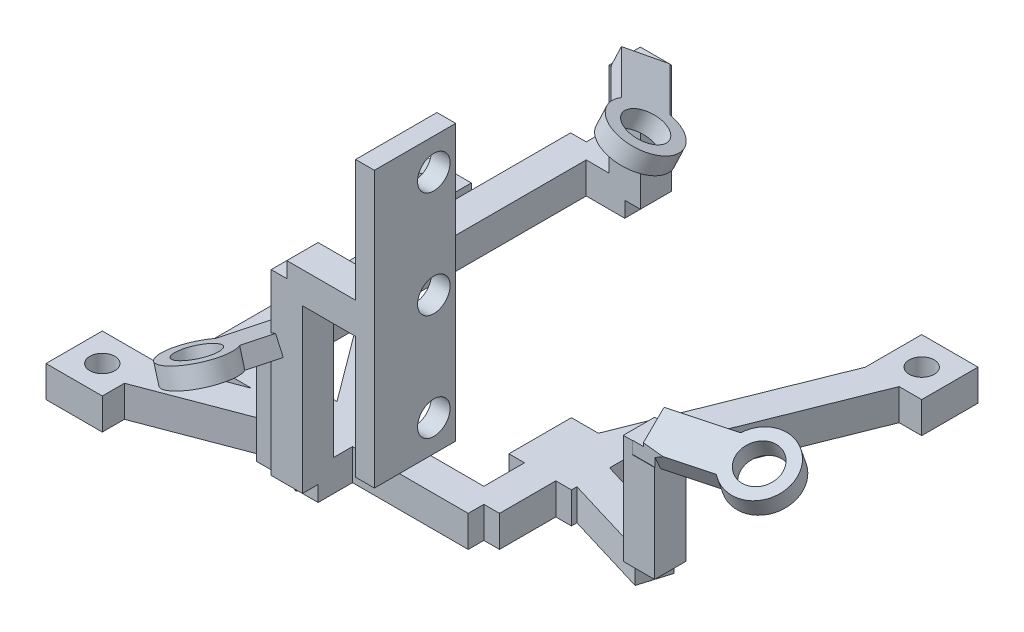
from build123d import *

# Parameters (mm, degrees)
CABLE_FAIRLEAD_SUPPORT_FRAME_FEATURE_PRO_W     = 10
CABLE_FAIRLEAD_SUPPORT_FRAME_FEATURE_PRO_H     = 5
CABLE_FAIRLEAD_SUPPORT_FRAME_FEATURE_DEPTH     = 10
FRAME_UPPER_TRUNK_SKETCH_W                     = 5
FRAME_UPPER_TRUNK_SKETCH_H                     = 5
FRAME_UPPER_TRUNK_FEATURE_DEPTH                = 14
FRAME_LEFT_TRUNK_SKETCH_W                      = 5
FRAME_LEFT_TRUNK_SKETCH_H                      = 5
FRAME_LEFT_TRUNK_FEATURE_DEPTH                 = 21
FIXED_FRAME_MOUNTING_WEB_1_SKETCH_W            = 5
FIXED_FRAME_MOUNTING_WEB_1_SKETCH_H            = 5
FIXED_FRAME_MOUNTING_WEB_1_FEATURE_DEPTH       = 48.600411521
PRISMATIC_M4_MOUNTING_PAD_1_PROFILE_W          = 9
PRISMATIC_M4_MOUNTING_PAD_1_PROFILE_H          = 5
PRISMATIC_M4_MOUNTING_PAD_1_DEPTH              = 9
NOMINAL_M4_MOUNTING_THREAD_1_PROFILE_R         = 2
NOMINAL_M4_MOUNTING_THREAD_1_DEPTH             = 9.1
FIXED_FRAME_MOUNTING_WEB_2_SKETCH_W            = 5
FIXED_FRAME_MOUNTING_WEB_2_SKETCH_H            = 5
FIXED_FRAME_MOUNTING_WEB_2_FEATURE_DEPTH       = 31.016124839
PRISMATIC_M4_MOUNTING_PAD_2_PROFILE_W          = 9
PRISMATIC_M4_MOUNTING_PAD_2_PROFILE_H          = 5
PRISMATIC_M4_MOUNTING_PAD_2_DEPTH              = 9
NOMINAL_M4_MOUNTING_THREAD_2_PROFILE_R         = 2
NOMINAL_M4_MOUNTING_THREAD_2_DEPTH             = 9.1
FIXED_FRAME_MOUNTING_WEB_3_SKETCH_W            = 5
FIXED_FRAME_MOUNTING_WEB_3_SKETCH_H            = 5
FIXED_FRAME_MOUNTING_WEB_3_FEATURE_DEPTH       = 43.081318457
PRISMATIC_M4_MOUNTING_PAD_3_PROFILE_W          = 9
PRISMATIC_M4_MOUNTING_PAD_3_PROFILE_H          = 5
PRISMATIC_M4_MOUNTING_PAD_3_DEPTH              = 9
NOMINAL_M4_MOUNTING_THREAD_3_PROFILE_R         = 2
NOMINAL_M4_MOUNTING_THREAD_3_DEPTH             = 9.1
OUTLET_SIDE_RISE_SKETCH_W                      = 5
OUTLET_SIDE_RISE_SKETCH_H                      = 5
OUTLET_SIDE_RISE_FEATURE_DEPTH                 = 8
OUTLET_LATERAL_RETURN_SKETCH_W                 = 5
OUTLET_LATERAL_RETURN_SKETCH_H                 = 5
OUTLET_LATERAL_RETURN_FEATURE_DEPTH            = 28.5
OUTLET_RAIL_BRIDGE_SKETCH_W                    = 5
OUTLET_RAIL_BRIDGE_SKETCH_H                    = 5
OUTLET_RAIL_BRIDGE_FEATURE_DEPTH               = 13
INTEGRAL_THREE_LANE_CABLE_OUTLET_CLA_2_W       = 3
INTEGRAL_THREE_LANE_CABLE_OUTLET_CLA_2_H       = 44
INTEGRAL_THREE_LANE_CABLE_OUTLET_CLAMP_R_DEPTH = 13
INLET_OUTRIGGER_WEB_1_SKETCH_W                 = 5
INLET_OUTRIGGER_WEB_1_SKETCH_H                 = 5
INLET_OUTRIGGER_WEB_1_FEATURE_DEPTH            = 19.897129262
INLET_VERTICAL_SUPPORT_1_SKETCH_W              = 5
INLET_VERTICAL_SUPPORT_1_SKETCH_H              = 5
INLET_VERTICAL_SUPPORT_1_FEATURE_DEPTH         = 17.458078567
INLET_COLLAR_RETAINING_WEB_1_FEATURE_DEPTH     = 14
INTEGRAL_CABLE_GUIDE_CLAMP_1_PROFILE_R         = 5
INTEGRAL_CABLE_GUIDE_CLAMP_1_DEPTH             = 2.99
FINAL_CABLE_INLET_CLAMP_THROUGH_BORE_1_P_R     = 3.1
FINAL_CABLE_INLET_CLAMP_THROUGH_BORE_1_DEPTH   = 7.2
INLET_OUTRIGGER_WEB_2_SKETCH_W                 = 5
INLET_OUTRIGGER_WEB_2_SKETCH_H                 = 5
INLET_OUTRIGGER_WEB_2_FEATURE_DEPTH            = 7.887446615
INLET_VERTICAL_SUPPORT_2_SKETCH_W              = 5
INLET_VERTICAL_SUPPORT_2_SKETCH_H              = 5
INLET_VERTICAL_SUPPORT_2_FEATURE_DEPTH         = 17.453498372
INLET_COLLAR_RETAINING_WEB_2_FEATURE_DEPTH     = 11.5
INTEGRAL_CABLE_GUIDE_CLAMP_2_PROFILE_R         = 5
INTEGRAL_CABLE_GUIDE_CLAMP_2_DEPTH             = 2.98
FINAL_CABLE_INLET_CLAMP_THROUGH_BORE_2_P_R     = 3.1
FINAL_CABLE_INLET_CLAMP_THROUGH_BORE_2_DEPTH   = 7.2
THIRD_INLET_CABLE_SWEEP_LEFT_BYPASS_SKET_W     = 5
THIRD_INLET_CABLE_SWEEP_LEFT_BYPASS_SKET_H     = 5
THIRD_INLET_CABLE_SWEEP_LEFT_BYPASS_FEAT_DEPTH = 21
THIRD_INLET_CABLE_SWEEP_LOWER_BYPASS_SKE_W     = 5
THIRD_INLET_CABLE_SWEEP_LOWER_BYPASS_SKE_H     = 5
THIRD_INLET_CABLE_SWEEP_LOWER_BYPASS_FEA_DEPTH = 58.366913444
THIRD_INLET_CABLE_SWEEP_RETURN_SKETCH_W        = 5
THIRD_INLET_CABLE_SWEEP_RETURN_SKETCH_H        = 5
THIRD_INLET_CABLE_SWEEP_RETURN_FEATURE_DEPTH   = 8.658958227
INLET_VERTICAL_SUPPORT_3_SKETCH_W              = 5
INLET_VERTICAL_SUPPORT_3_SKETCH_H              = 5
INLET_VERTICAL_SUPPORT_3_FEATURE_DEPTH         = 17.458078567
INLET_COLLAR_RETAINING_WEB_3_FEATURE_DEPTH     = 14
INTEGRAL_CABLE_GUIDE_CLAMP_3_PROFILE_R         = 5
INTEGRAL_CABLE_GUIDE_CLAMP_3_DEPTH             = 2.99
FINAL_CABLE_INLET_CLAMP_THROUGH_BORE_3_P_R     = 3.1
FINAL_CABLE_INLET_CLAMP_THROUGH_BORE_3_DEPTH   = 7.2
CABLE_OUTLET_CLAMP_BORE_1_PROFILE_R            = 2.6
CABLE_OUTLET_CLAMP_BORE_1_DEPTH                = 7.4
CABLE_OUTLET_CLAMP_BORE_2_PROFILE_R            = 2.6
CABLE_OUTLET_CLAMP_BORE_2_DEPTH                = 7.4
OUTLET_REAR_NUT_SEATING_CLEARANCE_2_PROF_R     = 4.75
OUTLET_REAR_NUT_SEATING_CLEARANCE_2_DEPTH      = 2.1
CABLE_OUTLET_CLAMP_BORE_3_PROFILE_R            = 2.6
CABLE_OUTLET_CLAMP_BORE_3_DEPTH                = 7.4
FIRST_INLET_WEB_COMB_CORNER_CLEARANCE_PR_W     = 5
FIRST_INLET_WEB_COMB_CORNER_CLEARANCE_PR_H     = 4
FIRST_INLET_WEB_COMB_CORNER_CLEARANCE_DEPTH    = 1.3
FIRST_WALL_MOUNT_OUTER_CORNER_RAIL_H_2_W       = 1.8
FIRST_WALL_MOUNT_OUTER_CORNER_RAIL_H_2_H       = 1.3
FIRST_WALL_MOUNT_OUTER_CORNER_RAIL_HEAD_DEPTH  = 5.1


with BuildPart() as part:
    # Cable Fairlead Support Frame Feature pro → Cable Fairlead Support Frame Feature (new body)
    with BuildSketch(Plane.XY.offset(-5)):
        with Locations((-50.291651246, -57.5)):
            Rectangle(CABLE_FAIRLEAD_SUPPORT_FRAME_FEATURE_PRO_W, CABLE_FAIRLEAD_SUPPORT_FRAME_FEATURE_PRO_H)
    extrude(amount=CABLE_FAIRLEAD_SUPPORT_FRAME_FEATURE_DEPTH)

    # Frame Upper Trunk Sketch → Frame Upper Trunk Feature (add)
    with BuildSketch(Plane.XY):
        with Locations((-50.291651246, -57.5)):
            Rectangle(FRAME_UPPER_TRUNK_SKETCH_W, FRAME_UPPER_TRUNK_SKETCH_H)
    extrude(amount=FRAME_UPPER_TRUNK_FEATURE_DEPTH)

    # Frame Left Trunk Sketch → Frame Left Trunk Feature (add)
    with BuildSketch(Plane.ZY.offset(50.291651246)):
        with Locations((14, -57.5)):
            Rectangle(FRAME_LEFT_TRUNK_SKETCH_W, FRAME_LEFT_TRUNK_SKETCH_H)
    extrude(amount=FRAME_LEFT_TRUNK_FEATURE_DEPTH)

    # Fixed Frame Mounting Web 1 Sketch → Fixed Frame Mounting Web 1 Feature (add)
    with BuildSketch(Plane(origin=(-18.680050253, 0, -25.121446892), x_dir=(-0.8024623409461341, 0, 0.59670276634456), z_dir=(-0.59670276634456, 0, -0.8024623409461341))):
        with Locations((65.562704078, -57.5)):
            Rectangle(FIXED_FRAME_MOUNTING_WEB_1_SKETCH_W, FIXED_FRAME_MOUNTING_WEB_1_SKETCH_H)
    extrude(amount=FIXED_FRAME_MOUNTING_WEB_1_FEATURE_DEPTH)

    # Prismatic M4 Mounting Pad 1 profile → Prismatic M4 Mounting Pad 1 (add)
    with BuildSketch(Plane.XY.offset(-29.5)):
        with Locations((-100.291651246, -57.5)):
            Rectangle(PRISMATIC_M4_MOUNTING_PAD_1_PROFILE_W, PRISMATIC_M4_MOUNTING_PAD_1_PROFILE_H)
    extrude(amount=PRISMATIC_M4_MOUNTING_PAD_1_DEPTH)

    # Nominal M4 Mounting Thread 1 profile → Nominal M4 Mounting Thread 1 (cut)
    with BuildSketch(Plane(origin=(0, -51, 0), x_dir=(-1, 0, 0), z_dir=(0, -1, 0))):
        with Locations(Location((100.291651246, 25, 0), (0, 0, 270))):
            Circle(NOMINAL_M4_MOUNTING_THREAD_1_PROFILE_R)
    extrude(amount=NOMINAL_M4_MOUNTING_THREAD_1_DEPTH, mode=Mode.SUBTRACT)

    # Fixed Frame Mounting Web 2 Sketch → Fixed Frame Mounting Web 2 Feature (add)
    with BuildSketch(Plane(origin=(-66.967025673, 0, 25.4012856), x_dir=(0.35465423412053826, 0, 0.9349975263177837), z_dir=(-0.9349975263177837, 0, 0.35465423412053826))):
        with Locations((-12.193920603, -57.5)):
            Rectangle(FIXED_FRAME_MOUNTING_WEB_2_SKETCH_W, FIXED_FRAME_MOUNTING_WEB_2_SKETCH_H)
    extrude(amount=FIXED_FRAME_MOUNTING_WEB_2_FEATURE_DEPTH)

    # Prismatic M4 Mounting Pad 2 profile → Prismatic M4 Mounting Pad 2 (add)
    with BuildSketch(Plane.XY.offset(20.5)):
        with Locations((-100.291651246, -57.5)):
            Rectangle(PRISMATIC_M4_MOUNTING_PAD_2_PROFILE_W, PRISMATIC_M4_MOUNTING_PAD_2_PROFILE_H)
    extrude(amount=PRISMATIC_M4_MOUNTING_PAD_2_DEPTH)

    # Nominal M4 Mounting Thread 2 profile → Nominal M4 Mounting Thread 2 (cut)
    with BuildSketch(Plane(origin=(0, -51, 0), x_dir=(-1, 0, 0), z_dir=(0, -1, 0))):
        with Locations(Location((100.291651246, -25, 0), (0, 0, 270))):
            Circle(NOMINAL_M4_MOUNTING_THREAD_2_PROFILE_R)
    extrude(amount=NOMINAL_M4_MOUNTING_THREAD_2_DEPTH, mode=Mode.SUBTRACT)

    # Fixed Frame Mounting Web 3 Sketch → Fixed Frame Mounting Web 3 Feature (add)
    with BuildSketch(Plane(origin=(-6.936779482, 0, 17.341948706), x_dir=(-0.9284766908852594, 0, -0.3713906763541037), z_dir=(0.37139067635410367, 0, -0.9284766908852593))):
        with Locations((46.694625928, -57.5)):
            Rectangle(FIXED_FRAME_MOUNTING_WEB_3_SKETCH_W, FIXED_FRAME_MOUNTING_WEB_3_SKETCH_H)
    extrude(amount=FIXED_FRAME_MOUNTING_WEB_3_FEATURE_DEPTH)

    # Prismatic M4 Mounting Pad 3 profile → Prismatic M4 Mounting Pad 3 (add)
    with BuildSketch(Plane.XY.offset(-44.5)):
        with Locations((-34.291651246, -57.5)):
            Rectangle(PRISMATIC_M4_MOUNTING_PAD_3_PROFILE_W, PRISMATIC_M4_MOUNTING_PAD_3_PROFILE_H)
    extrude(amount=PRISMATIC_M4_MOUNTING_PAD_3_DEPTH)

    # Nominal M4 Mounting Thread 3 profile → Nominal M4 Mounting Thread 3 (cut)
    with BuildSketch(Plane(origin=(0, -51, 0), x_dir=(-1, 0, 0), z_dir=(0, -1, 0))):
        with Locations(Location((34.291651246, 40, 0), (0, 0, 270))):
            Circle(NOMINAL_M4_MOUNTING_THREAD_3_PROFILE_R)
    extrude(amount=NOMINAL_M4_MOUNTING_THREAD_3_DEPTH, mode=Mode.SUBTRACT)

    # Outlet Side Rise Sketch → Outlet Side Rise Feature (add)
    with BuildSketch(Plane.XY.offset(14)):
        with Locations((-71.291651246, -57.5)):
            Rectangle(OUTLET_SIDE_RISE_SKETCH_W, OUTLET_SIDE_RISE_SKETCH_H)
    extrude(amount=OUTLET_SIDE_RISE_FEATURE_DEPTH)

    # Outlet Lateral Return Sketch → Outlet Lateral Return Feature (add)
    with BuildSketch(Plane(origin=(0, -57.5, 0), x_dir=(1, 0, 0), z_dir=(0, 1, 0))):
        with Locations((-71.291651246, -22)):
            Rectangle(OUTLET_LATERAL_RETURN_SKETCH_W, OUTLET_LATERAL_RETURN_SKETCH_H)
    extrude(amount=OUTLET_LATERAL_RETURN_FEATURE_DEPTH)

    # Outlet Rail Bridge Sketch → Outlet Rail Bridge Feature (add)
    with BuildSketch(Plane(origin=(-71.291651246, 0, 0), x_dir=(0, 0, -1), z_dir=(1, 0, 0))):
        with Locations((-22, -29)):
            Rectangle(OUTLET_RAIL_BRIDGE_SKETCH_W, OUTLET_RAIL_BRIDGE_SKETCH_H)
    extrude(amount=OUTLET_RAIL_BRIDGE_FEATURE_DEPTH)

    # Integral Three Lane Cable Outlet Cla 2 → Integral Three Lane Cable Outlet Clamp R (add)
    with BuildSketch(Plane.XY.offset(11.5)):
        with Locations((-58.791651246, -29)):
            Rectangle(INTEGRAL_THREE_LANE_CABLE_OUTLET_CLA_2_W, INTEGRAL_THREE_LANE_CABLE_OUTLET_CLA_2_H)
    extrude(amount=INTEGRAL_THREE_LANE_CABLE_OUTLET_CLAMP_R_DEPTH)

    # Inlet Outrigger Web 1 Sketch → Inlet Outrigger Web 1 Feature (add)
    with BuildSketch(Plane(origin=(-46.088198712, 0, -13.918676505), x_dir=(0.28910468276520457, 0, -0.9572974889778153), z_dir=(0.9572974889778154, 0, 0.28910468276520457))):
        with Locations((-14.539551879, -57.5)):
            Rectangle(INLET_OUTRIGGER_WEB_1_SKETCH_W, INLET_OUTRIGGER_WEB_1_SKETCH_H)
    extrude(amount=INLET_OUTRIGGER_WEB_1_FEATURE_DEPTH)

    # Inlet Vertical Support 1 Sketch → Inlet Vertical Support 1 Feature (add)
    with BuildSketch(Plane(origin=(0, -57.5, 0), x_dir=(1, 0, 0), z_dir=(0, 1, 0))):
        with Locations((-31.244179366, -5.752353243)):
            Rectangle(INLET_VERTICAL_SUPPORT_1_SKETCH_W, INLET_VERTICAL_SUPPORT_1_SKETCH_H)
    extrude(amount=INLET_VERTICAL_SUPPORT_1_FEATURE_DEPTH)

    # Inlet Collar Retaining Web 1 Sketch → Inlet Collar Retaining Web 1 Feature (add)
    with BuildSketch(Plane(origin=(-30.589304519, 0, 8.196379443), x_dir=(-0.2588190451025209, 0, -0.9659258262890683), z_dir=(0.9659258262890682, 0, -0.25881904510252085))):
        Polygon((-0.817503267, -39.875711022), (0.381753684, -42.614667532), (5.877987484, -40.208131845), (4.678730534, -37.469175335), align=None)
    extrude(amount=INLET_COLLAR_RETAINING_WEB_1_FEATURE_DEPTH)

    # Integral Cable Guide Clamp 1 profile → Integral Cable Guide Clamp 1 (add)
    with BuildSketch(Plane(origin=(-3.757886141, -33.160439592, -14.024622008), x_dir=(-0.9945971940532637, 0.09561015120206427, 0.040436624098617396), z_dir=(-0.10380954475082953, -0.916038966713815, -0.38742249532069234))):
        with Locations((13.883144322, -17.558147475)):
            Circle(INTEGRAL_CABLE_GUIDE_CLAMP_1_PROFILE_R)
    extrude(amount=INTEGRAL_CABLE_GUIDE_CLAMP_1_DEPTH)

    # Final Cable Inlet Clamp Through Bore 1 p → Final Cable Inlet Clamp Through Bore 1 (cut)
    with BuildSketch(Plane(origin=(-3.746467091, -33.059675306, -13.982005534), x_dir=(-0.9945971940532637, 0.09561015120206481, 0.040436624098617716), z_dir=(-0.10380954475083015, -0.9160389667138147, -0.3874224953206927))):
        with Locations(Location((13.883144322, -17.558147475, 0), (0, 0, 270))):
            Circle(FINAL_CABLE_INLET_CLAMP_THROUGH_BORE_1_P_R)
    extrude(amount=FINAL_CABLE_INLET_CLAMP_THROUGH_BORE_1_DEPTH, mode=Mode.SUBTRACT)

    # Inlet Outrigger Web 2 Sketch → Inlet Outrigger Web 2 Feature (add)
    with BuildSketch(Plane(origin=(-16.501146425, 0, 37.872417183), x_dir=(0.9167610626613684, 0, 0.39943604492834506), z_dir=(-0.39943604492834506, 0, 0.9167610626613684))):
        with Locations((-59.765305326, -57.5)):
            Rectangle(INLET_OUTRIGGER_WEB_2_SKETCH_W, INLET_OUTRIGGER_WEB_2_SKETCH_H)
    extrude(amount=INLET_OUTRIGGER_WEB_2_FEATURE_DEPTH)

    # Inlet Vertical Support 2 Sketch → Inlet Vertical Support 2 Feature (add)
    with BuildSketch(Plane(origin=(0, -57.5, 0), x_dir=(1, 0, 0), z_dir=(0, 1, 0))):
        with Locations((-74.442181727, -21.230903941)):
            Rectangle(INLET_VERTICAL_SUPPORT_2_SKETCH_W, INLET_VERTICAL_SUPPORT_2_SKETCH_H)
    extrude(amount=INLET_VERTICAL_SUPPORT_2_FEATURE_DEPTH)

    # Inlet Collar Retaining Web 2 Sketch → Inlet Collar Retaining Web 2 Feature (add)
    with BuildSketch(Plane(origin=(-10.294406604, 0, 38.419248481), x_dir=(0.9659258262890684, 0, 0.2588190451025205), z_dir=(-0.2588190451025205, 0, 0.9659258262890684))):
        Polygon((-69.756403539, -39.884871411), (-68.561157482, -42.614667532), (-63.064923681, -40.208131845), (-64.260169739, -37.478335724), align=None)
    extrude(amount=INLET_COLLAR_RETAINING_WEB_2_FEATURE_DEPTH)

    # Integral Cable Guide Clamp 2 profile → Integral Cable Guide Clamp 2 (add)
    with BuildSketch(Plane(origin=(3.315387624, -7.839049849, 0.888355436), x_dir=(-0.9219022779663189, -0.3849584828862101, 0.04362518005074423), z_dir=(0.387422495320693, -0.9160389667138146, 0.10380954475083053))):
        with Locations((88.199421816, -27.623992603)):
            Circle(INTEGRAL_CABLE_GUIDE_CLAMP_2_PROFILE_R)
    extrude(amount=INTEGRAL_CABLE_GUIDE_CLAMP_2_DEPTH)

    # Final Cable Inlet Clamp Through Bore 2 p → Final Cable Inlet Clamp Through Bore 2 (cut)
    with BuildSketch(Plane(origin=(3.268896925, -7.729125173, 0.875898291), x_dir=(-0.921902277966319, -0.38495848288620965, 0.04362518005074392), z_dir=(0.3874224953206925, -0.9160389667138148, 0.10380954475082999))):
        with Locations(Location((88.199421816, -27.623992603, 0), (0, 0, 2.513923103))):
            Circle(FINAL_CABLE_INLET_CLAMP_THROUGH_BORE_2_P_R)
    extrude(amount=FINAL_CABLE_INLET_CLAMP_THROUGH_BORE_2_DEPTH, mode=Mode.SUBTRACT)

    # Third Inlet Cable Sweep Left Bypass Sket → Third Inlet Cable Sweep Left Bypass Feature (add)
    with BuildSketch(Plane.ZY.offset(71.291651246)):
        with Locations((14, -57.5)):
            Rectangle(THIRD_INLET_CABLE_SWEEP_LEFT_BYPASS_SKET_W, THIRD_INLET_CABLE_SWEEP_LEFT_BYPASS_SKET_H)
    extrude(amount=THIRD_INLET_CABLE_SWEEP_LEFT_BYPASS_FEAT_DEPTH)

    # Third Inlet Cable Sweep Lower Bypass Ske → Third Inlet Cable Sweep Lower Bypass Feature (add)
    with BuildSketch(Plane(origin=(0, 0, 14), x_dir=(-1, 0, 0), z_dir=(0, 0, -1))):
        with Locations((92.291651246, -57.5)):
            Rectangle(THIRD_INLET_CABLE_SWEEP_LOWER_BYPASS_SKE_W, THIRD_INLET_CABLE_SWEEP_LOWER_BYPASS_SKE_H)
    extrude(amount=THIRD_INLET_CABLE_SWEEP_LOWER_BYPASS_FEA_DEPTH)

    # Third Inlet Cable Sweep Return Sketch → Third Inlet Cable Sweep Return Feature (add)
    with BuildSketch(Plane(origin=(-92.291651246, 0, 0), x_dir=(0, 0, -1), z_dir=(1, 0, 0))):
        with Locations((44.366913444, -57.5)):
            Rectangle(THIRD_INLET_CABLE_SWEEP_RETURN_SKETCH_W, THIRD_INLET_CABLE_SWEEP_RETURN_SKETCH_H)
    extrude(amount=THIRD_INLET_CABLE_SWEEP_RETURN_FEATURE_DEPTH)

    # Inlet Vertical Support 3 Sketch → Inlet Vertical Support 3 Feature (add)
    with BuildSketch(Plane(origin=(0, -57.5, 0), x_dir=(1, 0, 0), z_dir=(0, 1, 0))):
        with Locations((-83.632693019, 44.366913444)):
            Rectangle(INLET_VERTICAL_SUPPORT_3_SKETCH_W, INLET_VERTICAL_SUPPORT_3_SKETCH_H)
    extrude(amount=INLET_VERTICAL_SUPPORT_3_FEATURE_DEPTH)

    # Inlet Collar Retaining Web 3 Sketch → Inlet Collar Retaining Web 3 Feature (add)
    with BuildSketch(Plane(origin=(-63.999803232, 0, -63.999803232), x_dir=(0.7071067811865468, -1.0547118733938963e-15, -0.7071067811865483), z_dir=(0.7071067811865483, -1.0547118733939003e-15, 0.7071067811865468))):
        Polygon((-29.913587431, -37.469175335), (-31.112844382, -40.208131845), (-25.616610582, -42.614667532), (-24.417353631, -39.875711022), align=None)
    extrude(amount=INLET_COLLAR_RETAINING_WEB_3_FEATURE_DEPTH)

    # Integral Cable Guide Clamp 3 profile → Integral Cable Guide Clamp 3 (add)
    with BuildSketch(Plane(origin=(-13.137304667, -42.432064433, 13.137304667), x_dir=(-0.9589388376059532, 0.27092501001970076, -0.08388053812874768), z_dir=(-0.2836129505698625, -0.9160389667138149, 0.28361295056986235))):
        with Locations((62.748414909, 44.768137691)):
            Circle(INTEGRAL_CABLE_GUIDE_CLAMP_3_PROFILE_R)
    extrude(amount=INTEGRAL_CABLE_GUIDE_CLAMP_3_DEPTH)

    # Final Cable Inlet Clamp Through Bore 3 p → Final Cable Inlet Clamp Through Bore 3 (cut)
    with BuildSketch(Plane(origin=(-13.106107242, -42.331300147, 13.106107242), x_dir=(-0.9589388376059532, 0.27092501001970104, -0.08388053812874786), z_dir=(-0.2836129505698628, -0.9160389667138148, 0.2836129505698625))):
        with Locations(Location((62.748414909, 44.768137691, 0), (0, 0, 354.981795923))):
            Circle(FINAL_CABLE_INLET_CLAMP_THROUGH_BORE_3_P_R)
    extrude(amount=FINAL_CABLE_INLET_CLAMP_THROUGH_BORE_3_DEPTH, mode=Mode.SUBTRACT)

    # Cable Outlet Clamp Bore 1 profile → Cable Outlet Clamp Bore 1 (cut)
    with BuildSketch(Plane(origin=(-62.391651246, 0, 0), x_dir=(0, 0, -1), z_dir=(1, 0, 0))):
        with Locations(Location((-15, -12, 0), (0, 0, 180))):
            Circle(CABLE_OUTLET_CLAMP_BORE_1_PROFILE_R)
    extrude(amount=CABLE_OUTLET_CLAMP_BORE_1_DEPTH, mode=Mode.SUBTRACT)

    # Cable Outlet Clamp Bore 2 profile → Cable Outlet Clamp Bore 2 (cut)
    with BuildSketch(Plane(origin=(-62.391651246, 0, 0), x_dir=(0, 0, -1), z_dir=(1, 0, 0))):
        with Locations(Location((-15, -29, 0), (0, 0, 180))):
            Circle(CABLE_OUTLET_CLAMP_BORE_2_PROFILE_R)
    extrude(amount=CABLE_OUTLET_CLAMP_BORE_2_DEPTH, mode=Mode.SUBTRACT)

    # Outlet Rear Nut Seating Clearance 2 prof → Outlet Rear Nut Seating Clearance 2 (cut)
    with BuildSketch(Plane(origin=(-62.391651246, 0, 0), x_dir=(0, 0, -1), z_dir=(1, 0, 0))):
        with Locations((-15, -29)):
            Circle(OUTLET_REAR_NUT_SEATING_CLEARANCE_2_PROF_R)
    extrude(amount=OUTLET_REAR_NUT_SEATING_CLEARANCE_2_DEPTH, mode=Mode.SUBTRACT)

    # Cable Outlet Clamp Bore 3 profile → Cable Outlet Clamp Bore 3 (cut)
    with BuildSketch(Plane(origin=(-62.391651246, 0, 0), x_dir=(0, 0, -1), z_dir=(1, 0, 0))):
        with Locations(Location((-15, -46, 0), (0, 0, 180))):
            Circle(CABLE_OUTLET_CLAMP_BORE_3_PROFILE_R)
    extrude(amount=CABLE_OUTLET_CLAMP_BORE_3_DEPTH, mode=Mode.SUBTRACT)

    # First Inlet Web Comb Corner Clearance pr → First Inlet Web Comb Corner Clearance (cut)
    with BuildSketch(Plane.XY.offset(8.2)):
        with Locations((-29.791651246, -40)):
            Rectangle(FIRST_INLET_WEB_COMB_CORNER_CLEARANCE_PR_W, FIRST_INLET_WEB_COMB_CORNER_CLEARANCE_PR_H)
    extrude(amount=FIRST_INLET_WEB_COMB_CORNER_CLEARANCE_DEPTH, mode=Mode.SUBTRACT)

    # First Wall Mount Outer Corner Rail H 2 → First Wall Mount Outer Corner Rail Head (cut)
    with BuildSketch(Plane.XY.offset(-29.6)):
        with Locations((-103.991651246, -55.55)):
            Rectangle(FIRST_WALL_MOUNT_OUTER_CORNER_RAIL_H_2_W, FIRST_WALL_MOUNT_OUTER_CORNER_RAIL_H_2_H)
    extrude(amount=FIRST_WALL_MOUNT_OUTER_CORNER_RAIL_HEAD_DEPTH, mode=Mode.SUBTRACT)


solid = part.part
